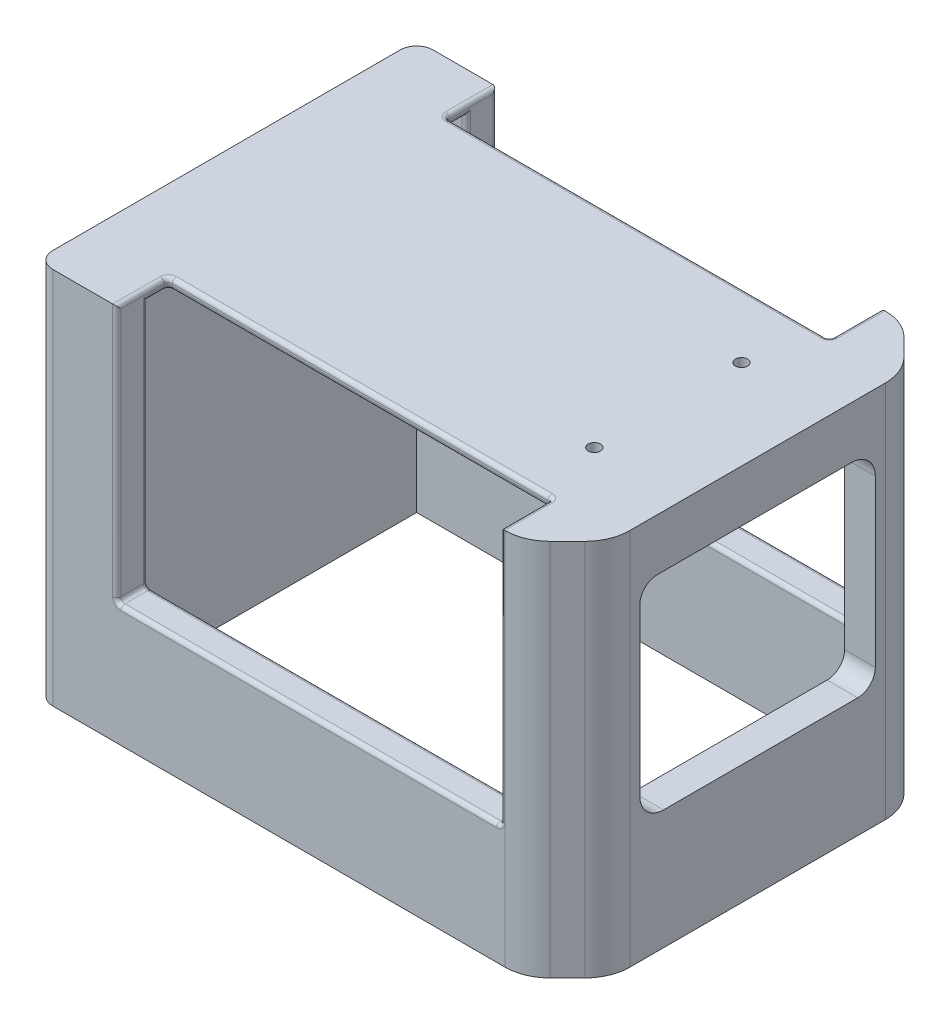
from build123d import *

# Parameters (mm, degrees)
SALIENTE_EXTRUIR1_DEPTH = 2.5
SALIENTE_EXTRUIR2_START = 90
SALIENTE_EXTRUIR2_DEPTH = 90
CORTAR_EXTRUIR2_REACH   = 171.292
CORTAR_EXTRUIR4_DEPTH   = 63
REDONDEO1_R             = 1
CORTAR_EXTRUIR5_REACH   = 171.292
CROQUIS7_R              = 1.5
CORTAR_EXTRUIR6_DEPTH   = 5


with BuildPart() as part:
    # Croquis1 → Saliente-Extruir1 (new body)
    with BuildSketch(Plane(origin=(0, 95.6, 0), x_dir=(1, 0, 0), z_dir=(0, 1, 0))):
        with BuildLine():
            Line((327.757359313, -46.5), (227.242640687, -46.5))
            Line((227.242640687, -46.5), (217.1, -46.5))
            ThreePointArc((217.1, -46.5), (214.271572875, -45.328427125), (213.1, -42.5))
            Line((213.1, -42.5), (213.1, 42.5))
            ThreePointArc((213.1, 42.5), (214.271572875, 45.328427125), (217.1, 46.5))
            Line((217.1, 46.5), (227.242640687, 46.5))
            Line((227.242640687, 46.5), (327.757359313, 46.5))
            ThreePointArc((327.757359313, 46.5), (331.966877069, 45.662674858), (335.535533906, 43.278174593))
            Line((335.535533906, 43.278174593), (339.778174891, 39.035533608))
            ThreePointArc((339.778174891, 39.035533608), (342.162674938, 35.466876874), (343, 31.257359313))
            Line((343, 31.257359313), (343, -31.257359312))
            ThreePointArc((343, -31.257359312), (342.162674858, -35.466877069), (339.778174593, -39.035533906))
            Line((339.778174593, -39.035533906), (335.535533608, -43.278174891))
            ThreePointArc((335.535533608, -43.278174891), (331.966876874, -45.662674939), (327.757359313, -46.5))
        make_face()
    extrude(amount=SALIENTE_EXTRUIR1_DEPTH)

    # Croquis2 → Saliente-Extruir2 (add)
    with BuildSketch(Plane.XZ.offset(-95.6).offset(SALIENTE_EXTRUIR2_START)):
        with BuildLine():
            Line((213.1, 42.5), (213.1, -42.5))
            ThreePointArc((213.1, -42.5), (214.271572875, -45.328427125), (217.1, -46.5))
            Line((217.1, -46.5), (327.757359313, -46.5))
            ThreePointArc((327.757359313, -46.5), (331.966877069, -45.662674858), (335.535533906, -43.278174593))
            Line((335.535533906, -43.278174593), (339.778174891, -39.035533608))
            ThreePointArc((339.778174891, -39.035533608), (342.162674938, -35.466876874), (343, -31.257359313))
            Line((343, -31.257359313), (343, 31.257359312))
            ThreePointArc((343, 31.257359312), (342.162674858, 35.466877069), (339.778174593, 39.035533906))
            Line((339.778174593, 39.035533906), (335.535533608, 43.278174891))
            ThreePointArc((335.535533608, 43.278174891), (331.966876874, 45.662674939), (327.757359313, 46.5))
            Line((327.757359313, 46.5), (217.1, 46.5))
            ThreePointArc((217.1, 46.5), (214.271572875, 45.328427125), (213.1, 42.5))
        make_face()
        with BuildLine():
            Line((220.6, 39), (220.6, -39))
            Line((220.6, -39), (327.757359313, -39))
            ThreePointArc((327.757359313, -39), (329.096751326, -38.733578364), (330.232233047, -37.974873734))
            Line((330.232233047, -37.974873734), (334.474874032, -33.732232749))
            ThreePointArc((334.474874032, -33.732232749), (335.233578444, -32.596751131), (335.5, -31.257359313))
            Line((335.5, -31.257359313), (335.5, 31.257359312))
            ThreePointArc((335.5, 31.257359312), (335.233578364, 32.596751326), (334.474873734, 33.732233047))
            Line((334.474873734, 33.732233047), (330.232232749, 37.974874033))
            ThreePointArc((330.232232749, 37.974874033), (329.096751131, 38.733578445), (327.757359313, 39))
            Line((327.757359313, 39), (220.6, 39))
        make_face(mode=Mode.SUBTRACT)
    extrude(amount=-SALIENTE_EXTRUIR2_DEPTH)

    # Croquis3 → Cortar-Extruir2 (cut, up to next)
    with BuildSketch(Plane(origin=(343, 0, 0), x_dir=(0, 0, -1), z_dir=(1, 0, 0)), mode=Mode.PRIVATE) as cortar_extruir2_sk1:
        with BuildLine():
            Line((23, 85.4), (-24.5, 85.4))
            ThreePointArc((-24.5, 85.4), (-27.540559159, 84.140559159), (-28.8, 81.1))
            Line((-28.8, 81.1), (-28.8, 40.6))
            ThreePointArc((-28.8, 40.6), (-27.101219331, 36.498780669), (-23, 34.8))
            Line((-23, 34.8), (24.5, 34.8))
            ThreePointArc((24.5, 34.8), (27.540559159, 36.059440841), (28.8, 39.1))
            Line((28.8, 39.1), (28.8, 79.6))
            ThreePointArc((28.8, 79.6), (27.101219331, 83.701219331), (23, 85.4))
        make_face()
    cortar_extruir2_tool1 = extrude(cortar_extruir2_sk1.sketch, amount=-CORTAR_EXTRUIR2_REACH, mode=Mode.PRIVATE) & part.part
    add(cortar_extruir2_tool1.solids().sort_by_distance((343, 60.1, 0))[0], mode=Mode.SUBTRACT)

    # Croquis4 → Cortar-Extruir4 (cut)
    with BuildSketch(Plane(origin=(0, 98.1, 0), x_dir=(1, 0, 0), z_dir=(0, 1, 0))):
        Polygon((232.757359313, -33.9), (232.757359313, -38.5), (232.757359313, -46.5), (326.657359313, -46.5), (326.657359313, -38.5), (326.657359313, -33.9), align=None)
        Polygon((326.657359313, 46.5), (232.757359313, 46.5), (232.757359313, 38.5), (232.757359313, 33.9), (326.657359313, 33.9), (326.657359313, 38.5), align=None)
    extrude(amount=-CORTAR_EXTRUIR4_DEPTH, mode=Mode.SUBTRACT)

    # Redondeo1
    redondeo1_edges = [part.edges().sort_by_distance(p)[0] for p in [
        (232.757359313, 95.6, -36.45),
        (279.707359313, 95.6, -33.9),
        (326.657359313, 95.6, -36.45),
        (279.707359313, 95.6, 33.9),
        (232.757359313, 95.6, 36.45),
        (326.657359313, 95.6, 36.45),
        (279.707359313, 35.1, 39),
        (279.707359313, 35.1, -39),
        (326.657359313, 65.35, 39),
        (232.757359313, 65.35, 39),
        (232.757359313, 96.85, 33.9),
        (326.657359313, 96.85, 33.9),
        (326.657359313, 35.1, 42.75),
        (279.707359313, 35.1, 46.5),
        (326.657359313, 66.6, 46.5),
        (232.757359313, 35.1, 42.75),
        (232.757359313, 66.6, 46.5),
        (326.657359313, 98.1, 40.2),
        (279.707359313, 98.1, 33.9),
        (232.757359313, 98.1, 40.2),
        (326.657359313, 65.35, -39),
        (326.657359313, 96.85, -33.9),
        (232.757359313, 65.35, -39),
        (326.657359313, 35.1, -42.75),
        (326.657359313, 66.6, -46.5),
        (232.757359313, 96.85, -33.9),
        (232.757359313, 35.1, -42.75),
        (279.707359313, 35.1, -46.5),
        (232.757359313, 66.6, -46.5),
        (326.657359313, 98.1, -40.2),
        (232.757359313, 98.1, -40.2),
        (279.707359313, 98.1, -33.9),
    ]]
    fillet(redondeo1_edges, radius=REDONDEO1_R)

    # Croquis5 → Cortar-Extruir5 (cut, up to next)
    with BuildSketch(Plane.ZY.offset(-213.1), mode=Mode.PRIVATE) as cortar_extruir5_sk1:
        with BuildLine():
            Line((-19.675765155, 71.72423484), (-19.675765155, 48.475765161))
            ThreePointArc((-19.675765155, 48.475765161), (-21.433124468, 44.233124467), (-25.675765163, 42.475765155))
            Line((-25.675765163, 42.475765155), (-31.024234836, 42.475765155))
            ThreePointArc((-31.024234836, 42.475765155), (-35.266875531, 44.233124467), (-37.024234845, 48.475765162))
            Line((-37.024234845, 48.475765162), (-37.024234845, 71.724234837))
            ThreePointArc((-37.024234845, 71.724234837), (-35.266875532, 75.966875532), (-31.024234837, 77.724234845))
            Line((-31.024234837, 77.724234845), (-25.675765164, 77.724234845))
            ThreePointArc((-25.675765164, 77.724234845), (-21.433124469, 75.966875534), (-19.675765155, 71.72423484))
        make_face()
    cortar_extruir5_tool1 = extrude(cortar_extruir5_sk1.sketch, amount=-CORTAR_EXTRUIR5_REACH, mode=Mode.PRIVATE) & part.part
    add(cortar_extruir5_tool1.solids().sort_by_distance((213.1, 60.1, -28.35))[0], mode=Mode.SUBTRACT)

    # Croquis7 → Cortar-Extruir6 (cut)
    with BuildSketch(Plane(origin=(0, 98.1, 0), x_dir=(1, 0, 0), z_dir=(0, 1, 0))):
        with Locations(Location((321.080026167, 18.000457457, 0), (0, 0, 270))):
            Circle(CROQUIS7_R)
        with Locations(Location((321.080026167, -18.000457457, 0), (0, 0, 270))):
            Circle(CROQUIS7_R)
    extrude(amount=-CORTAR_EXTRUIR6_DEPTH, mode=Mode.SUBTRACT)


solid = part.part
